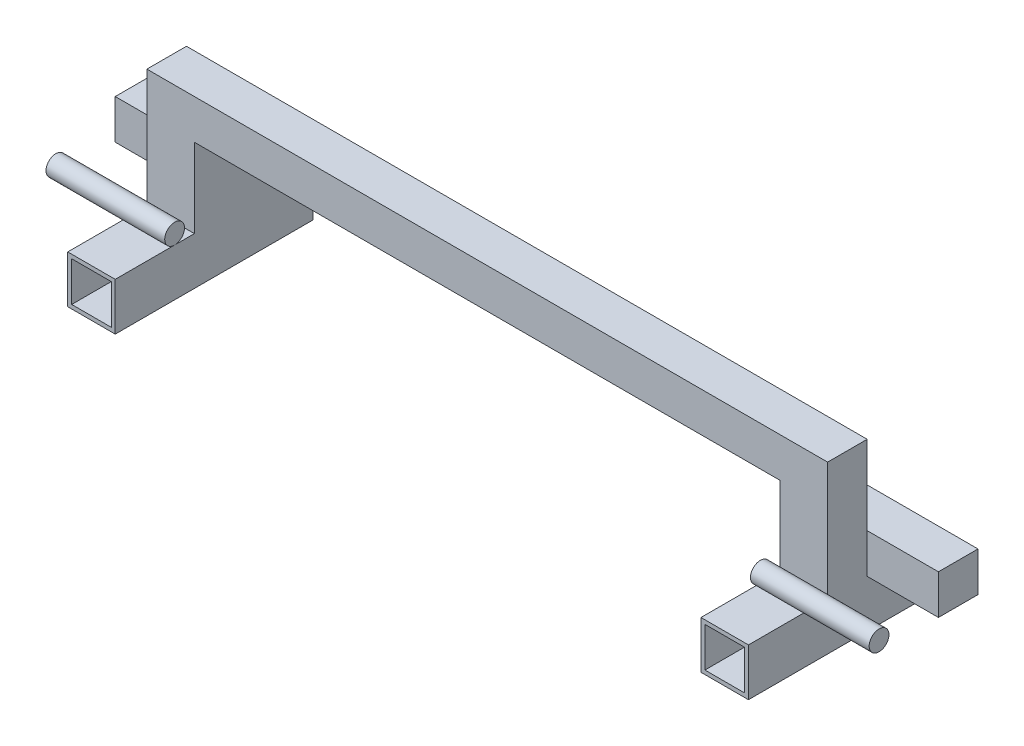
from build123d import *

# Parameters (mm, degrees)
SKETCH1_W           = 12
SKETCH1_H           = 12
SKETCH1_W_2         = 10
SKETCH1_H_2         = 10
BOSS_EXTRUDE1_DEPTH = 50
SKETCH2_W           = 10
SKETCH2_H           = 10
SKETCH2_R           = 2.5
BOSS_EXTRUDE2_DEPTH = 30
SKETCH3_W           = 12
SKETCH3_H           = 10
BOSS_EXTRUDE3_DEPTH = 20
BOSS_EXTRUDE4_START = -172
SKETCH5_W           = 10
SKETCH5_H           = 10
BOSS_EXTRUDE4_DEPTH = 172


with BuildPart() as part:
    # Sketch1 → Boss-Extrude1 (new body)
    with BuildSketch(Plane.XY):
        with Locations((-108.754467624, 18.379588337)):
            Rectangle(SKETCH1_W, SKETCH1_H)
        with Locations((-108.754467624, 18.379588337)):
            Rectangle(SKETCH1_W_2, SKETCH1_H_2, mode=Mode.SUBTRACT)
    extrude(amount=BOSS_EXTRUDE1_DEPTH)

    # Sketch2 → Boss-Extrude2 (add)
    with BuildSketch(Plane(origin=(-102.754467624, 0, 0), x_dir=(0, 0, -1), z_dir=(1, 0, 0))):
        with Locations((-15, 29.379588337)):
            Rectangle(SKETCH2_W, SKETCH2_H)
        with Locations((-35, 26.879588337)):
            Circle(SKETCH2_R)
    extrude(amount=-BOSS_EXTRUDE2_DEPTH)


with BuildPart() as boss_extrude2_piece_1:
    # of the separate pieces the step leaves, piece 1, a body of its own (boss_extrude2_pieces)
    add(part.part.solids().sort_by_distance((-114.754467624, 24.379588337, 0))[0])

    # Sketch3 → Boss-Extrude3 (add)
    with BuildSketch(Plane(origin=(0, 24.379588337, 0), x_dir=(1, 0, 0), z_dir=(0, 1, 0))):
        with Locations((-108.754467624, -25)):
            Rectangle(SKETCH3_W, SKETCH3_H)
    extrude(amount=BOSS_EXTRUDE3_DEPTH)


with BuildPart() as boss_extrude2_piece_2:
    # of the separate pieces the step leaves, piece 2, a body of its own (boss_extrude2_pieces)
    add(part.part.solids().sort_by_distance((-102.754467624, 26.879588337, 32.5))[0])


with BuildPart() as body_3:
    # Mirror6: mirrored copy
    add(boss_extrude2_piece_1.part.mirror(Plane.ZY.offset(28.754467624)))


with BuildPart() as body_4:
    # Mirror6 2: mirrored copy
    add(boss_extrude2_piece_2.part.mirror(Plane.ZY.offset(28.754467624)))


with BuildPart() as boss_extrude2_piece_1_1:
    add(boss_extrude2_piece_1.part)

    add(body_3.part)  # Boss-Extrude4 merges body 3
    # Sketch5 → Boss-Extrude4 (add)
    with BuildSketch(Plane.ZY.offset(114.754467624).offset(BOSS_EXTRUDE4_START)):
        with Locations((25, 49.379588337)):
            Rectangle(SKETCH5_W, SKETCH5_H)
    extrude(amount=BOSS_EXTRUDE4_DEPTH)


solid = Compound([boss_extrude2_piece_2.part, body_4.part, boss_extrude2_piece_1_1.part])
